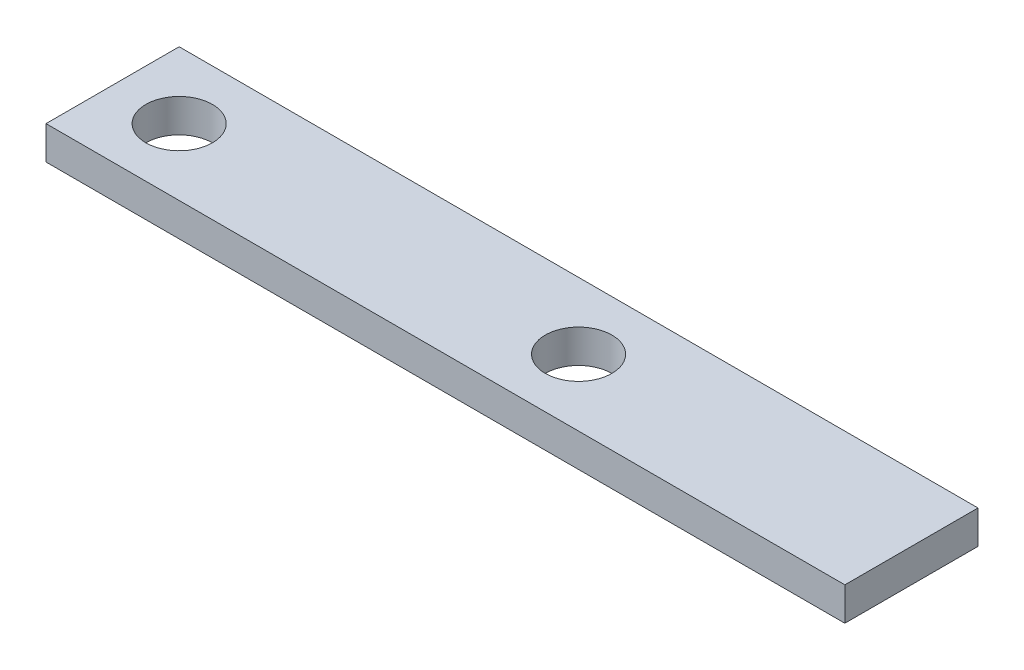
from build123d import *

# Parameters (mm, degrees)
SKETCH1_W           = 76.2
SKETCH1_H           = 12.7
SKETCH1_R           = 3.175
BOSS_EXTRUDE2_DEPTH = 3.175


with BuildPart() as part:
    # Sketch1 → Boss-Extrude2 (new body)
    with BuildSketch(Plane(origin=(0, 0, 0), x_dir=(1, 0, 0), z_dir=(0, 1, 0))):
        with Locations((38.1, 6.35)):
            Rectangle(SKETCH1_W, SKETCH1_H)
        with Locations(Location((6.35, 6.35, 0), (0, 0, 270))):
            Circle(SKETCH1_R, mode=Mode.SUBTRACT)
        with Locations(Location((44.45, 6.35, 0), (0, 0, 270))):
            Circle(SKETCH1_R, mode=Mode.SUBTRACT)
    extrude(amount=BOSS_EXTRUDE2_DEPTH)


solid = part.part
